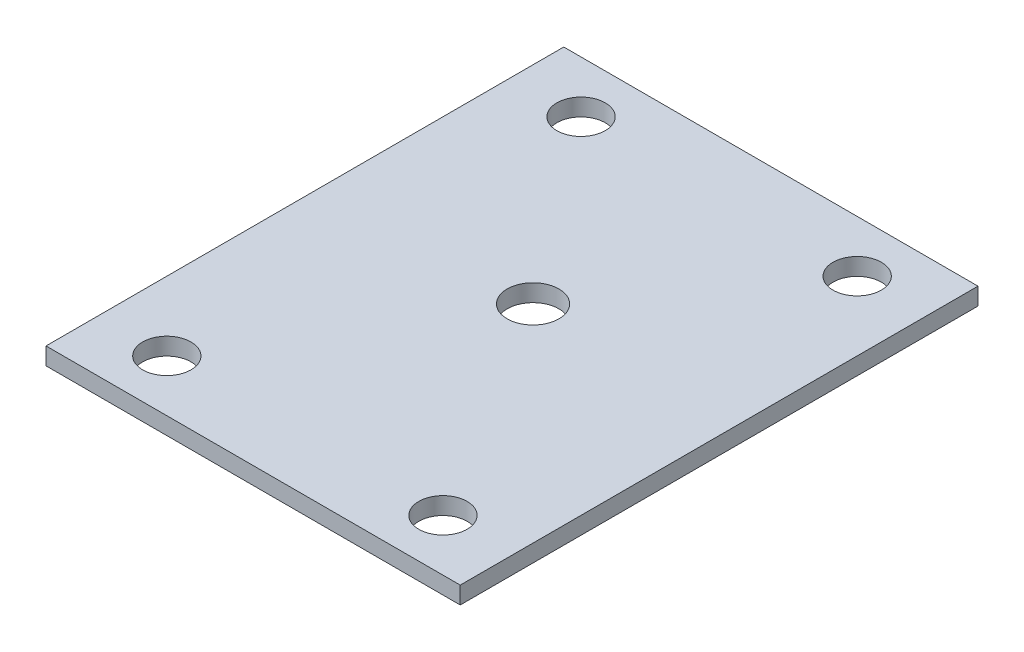
from build123d import *

# Parameters (mm, degrees)
SKETCH1_W           = 30.48
SKETCH1_H           = 38.1
SKETCH1_R           = 1.778
BOSS_EXTRUDE1_DEPTH = 1.27
SKETCH2_R           = 1.778
SKETCH2_R_2         = 1.905
CUT_EXTRUDE1_DEPTH  = 25.428937758


with BuildPart() as part:
    # Sketch1 → Boss-Extrude1 (new body)
    with BuildSketch(Plane(origin=(0, 0, 0), x_dir=(1, 0, 0), z_dir=(0, 1, 0))):
        Rectangle(SKETCH1_W, SKETCH1_H)
        with Locations(Location((-10.16, 15.24, 0), (0, 0, 270))):
            Circle(SKETCH1_R, mode=Mode.SUBTRACT)
        with Locations(Location((10.16, 15.24, 0), (0, 0, 90))):
            Circle(SKETCH1_R, mode=Mode.SUBTRACT)
        with Locations(Location((-10.16, -15.24, 0), (0, 0, 90))):
            Circle(SKETCH1_R, mode=Mode.SUBTRACT)
        with Locations(Location((10.16, -15.24, 0), (0, 0, 270))):
            Circle(SKETCH1_R, mode=Mode.SUBTRACT)
    extrude(amount=BOSS_EXTRUDE1_DEPTH)

    # Sketch2 → Cut-Extrude1 (cut, through all)
    with BuildSketch(Plane.XZ):
        with Locations(Location((-10.16, -15.24, 0), (0, 0, 90))):
            Circle(SKETCH2_R)
        with Locations(Location((10.16, -15.24, 0), (0, 0, 270))):
            Circle(SKETCH2_R)
        with Locations(Location((10.16, 15.24, 0), (0, 0, 90))):
            Circle(SKETCH2_R)
        with Locations(Location((-10.16, 15.24, 0), (0, 0, 270))):
            Circle(SKETCH2_R)
        with Locations(Location((0, -1.5494, 0), (0, 0, 270))):
            Circle(SKETCH2_R_2)
    extrude(amount=-CUT_EXTRUDE1_DEPTH, mode=Mode.SUBTRACT)


solid = part.part
